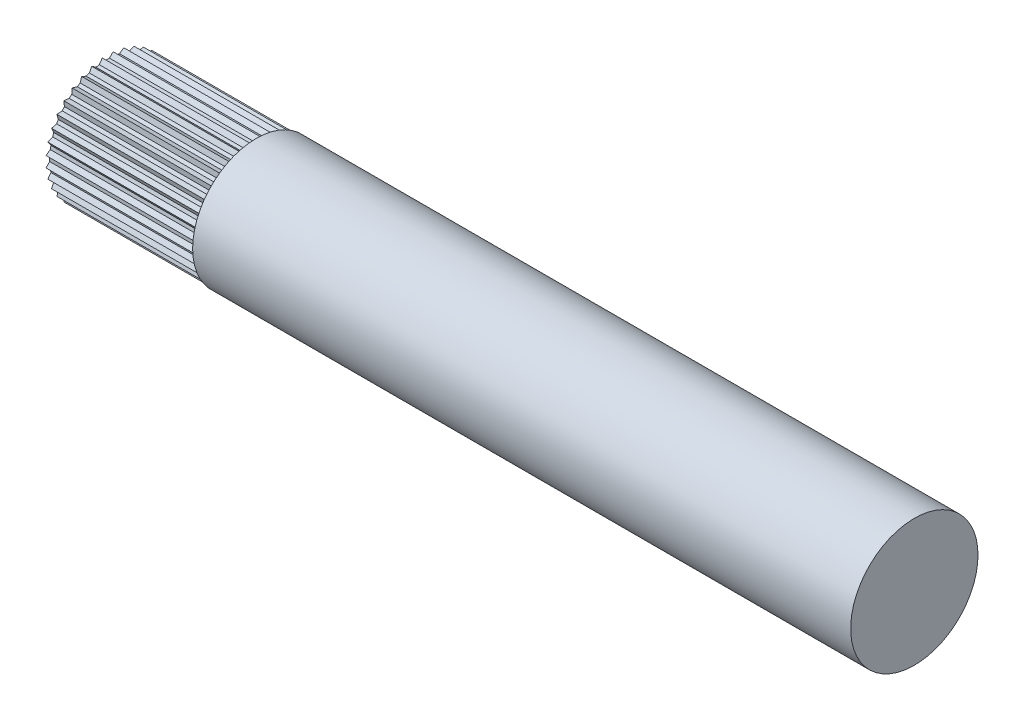
from build123d import *

# Parameters (mm, degrees)
SKETCH1_W           = 120.675
SKETCH1_H           = 1.5875
CUT_EXTRUDE2_START  = 19.25
SKETCH4_R           = 12.7
CUT_EXTRUDE2_DEPTH  = 22.225
BOSS_EXTRUDE1_START = -120.675
SKETCH5_R           = 7.9375
BOSS_EXTRUDE1_DEPTH = 120.675


with BuildPart() as part:
    # Sketch1 → Revolve1 (revolve)
    with BuildSketch(Plane(origin=(0, 0, 0), x_dir=(1, 0, 0), z_dir=(0, 1, 0))):
        with Locations((79.5875, 8.73125)):
            Rectangle(SKETCH1_W, SKETCH1_H)
    revolve(axis=Axis((157.324, 0, 0), (-1, 0, 0)))

    # Sketch4 → Cut-Extrude2 (cut)
    with BuildSketch(Plane(origin=(0, 0, 0), x_dir=(0, 0, -1), z_dir=(1, 0, 0)).offset(CUT_EXTRUDE2_START)):
        Circle(SKETCH4_R)
        Polygon((-9.235721046, 0.808020891), (-8.681700155, 0.254), (-8.681700155, -0.254), (-9.235721046, -0.808020891), (-8.593912259, -1.257420242), (-8.505698985, -1.75770258), (-8.955098336, -2.399511367), (-8.245002688, -2.730634406), (-8.071256455, -3.207998257), (-8.402379494, -3.918093905), (-7.645572882, -4.120879625), (-7.391572882, -4.56082053), (-7.594358603, -5.317627141), (-6.813836213, -5.385914002), (-6.487300108, -5.775064579), (-6.555586968, -6.555586968), (-5.775064579, -6.487300108), (-5.385914002, -6.813836213), (-5.317627141, -7.594358603), (-4.56082053, -7.391572882), (-4.120879625, -7.645572882), (-3.918093905, -8.402379494), (-3.207998257, -8.071256455), (-2.730634406, -8.245002688), (-2.399511367, -8.955098336), (-1.75770258, -8.505698985), (-1.257420242, -8.593912259), (-0.808020891, -9.235721046), (-0.254, -8.681700155), (0.254, -8.681700155), (0.808020891, -9.235721046), (1.257420242, -8.593912259), (1.75770258, -8.505698985), (2.399511367, -8.955098336), (2.730634406, -8.245002688), (3.207998257, -8.071256455), (3.918093905, -8.402379494), (4.120879625, -7.645572882), (4.56082053, -7.391572882), (5.317627141, -7.594358603), (5.385914002, -6.813836213), (5.775064579, -6.487300108), (6.555586968, -6.555586968), (6.487300108, -5.775064579), (6.813836213, -5.385914002), (7.594358603, -5.317627141), (7.391572882, -4.56082053), (7.645572882, -4.120879625), (8.402379494, -3.918093905), (8.071256455, -3.207998257), (8.245002688, -2.730634406), (8.955098336, -2.399511367), (8.505698985, -1.75770258), (8.593912259, -1.257420242), (9.235721046, -0.808020891), (8.681700155, -0.254), (8.681700155, 0.254), (9.235721046, 0.808020891), (8.593912259, 1.257420242), (8.505698985, 1.75770258), (8.955098336, 2.399511367), (8.245002688, 2.730634406), (8.071256455, 3.207998257), (8.402379494, 3.918093905), (7.645572882, 4.120879625), (7.391572882, 4.56082053), (7.594358603, 5.317627141), (6.813836213, 5.385914002), (6.487300108, 5.775064579), (6.555586968, 6.555586968), (5.775064579, 6.487300108), (5.385914002, 6.813836213), (5.317627141, 7.594358603), (4.56082053, 7.391572882), (4.120879625, 7.645572882), (3.918093905, 8.402379494), (3.207998257, 8.071256455), (2.730634406, 8.245002688), (2.399511367, 8.955098336), (1.75770258, 8.505698985), (1.257420242, 8.593912259), (0.808020891, 9.235721046), (0.254, 8.681700155), (-0.254, 8.681700155), (-0.808020891, 9.235721046), (-1.257420242, 8.593912259), (-1.75770258, 8.505698985), (-2.399511367, 8.955098336), (-2.730634406, 8.245002688), (-3.207998257, 8.071256455), (-3.918093905, 8.402379494), (-4.120879625, 7.645572882), (-4.56082053, 7.391572882), (-5.317627141, 7.594358603), (-5.385914002, 6.813836213), (-5.775064579, 6.487300108), (-6.555586968, 6.555586968), (-6.487300108, 5.775064579), (-6.813836213, 5.385914002), (-7.594358603, 5.317627141), (-7.391572882, 4.56082053), (-7.645572882, 4.120879625), (-8.402379494, 3.918093905), (-8.071256455, 3.207998257), (-8.245002688, 2.730634406), (-8.955098336, 2.399511367), (-8.505698985, 1.75770258), (-8.593912259, 1.257420242), align=None, mode=Mode.SUBTRACT)
    extrude(amount=CUT_EXTRUDE2_DEPTH, mode=Mode.SUBTRACT)

    # Sketch5 → Boss-Extrude1 (add)
    with BuildSketch(Plane(origin=(139.925, 0, 0), x_dir=(0, 0, -1), z_dir=(1, 0, 0)).offset(BOSS_EXTRUDE1_START)):
        Circle(SKETCH5_R)
    extrude(amount=BOSS_EXTRUDE1_DEPTH)


solid = part.part
